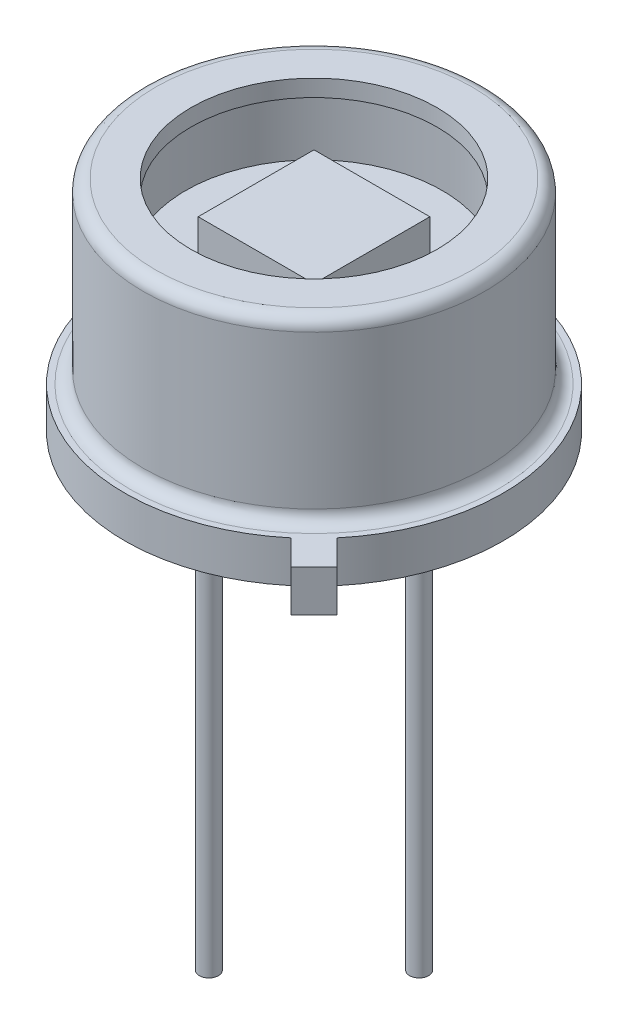
from build123d import *

# Parameters (mm, degrees)
BOSS_EXTRUDE1_DEPTH      = 1
FILLET1_R                = 0.3
BOSS_EXTRUDE2_DEPTH      = 10
BOSS_EXTRUDE2_DEPTH_BACK = 2.3
SKETCH6_R                = 0.23
SKETCH_2_R               = 3.1
EXTRUDE_1_DEPTH          = 1.2
SKETCH_3_W               = 2.8
SKETCH_3_H               = 2.8
EXTRUDE_2_DEPTH          = 1


with BuildPart() as part:
    # Sketch1 → Boss-Extrude1 (new body)
    with BuildSketch(Plane(origin=(0, 0, 0), x_dir=(1, 0, 0), z_dir=(0, 1, 0))):
        with BuildLine():
            Line((2.942495814, -3.499271693), (3.55315323, -4.10992911))
            Line((3.55315323, -4.10992911), (4.10992911, -3.55315323))
            Line((4.10992911, -3.55315323), (3.499271693, -2.942495814))
            ThreePointArc((3.499271693, -2.942495814), (-3.232892204, 3.232892204), (2.942495814, -3.499271693))
        make_face()
    extrude(amount=-BOSS_EXTRUDE1_DEPTH)

    # Sketch5 → Revolve4 (revolve)
    with BuildSketch(Plane.XY):
        Polygon((4.1275, 4.3), (2.9718, 4.3), (2.9718, 3.8936), (3.7211, 3.8936), (3.7211, 0.8936), (0, 0.8936), (0, 0), (4.1275, 0), align=None)
    revolve(axis=Axis((0, 0.8936, 0), (0, -1, 0)))

    # Fillet1
    fillet1_edges = [part.edges().sort_by_distance(p)[0] for p in [
        (-4.1275, 0, 0),
        (-4.1275, 4.3, 0),
    ]]
    fillet(fillet1_edges, radius=FILLET1_R)

    # Sketch6 → Boss-Extrude2 (add, two sides: drawn at the far end of the back side and taken through both)
    with BuildSketch(Plane.XZ.offset(1).offset(-BOSS_EXTRUDE2_DEPTH_BACK)):
        with Locations(Location((0, -2.54, 0), (0, 0, 270))):
            Circle(SKETCH6_R)
        with Locations(Location((-2.54, 0, 0), (0, 0, 270))):
            Circle(SKETCH6_R)
        with Locations(Location((0, 2.54, 0), (0, 0, 270))):
            Circle(SKETCH6_R)
        with Locations(Location((2.54, 0, 0), (0, 0, 270))):
            Circle(SKETCH6_R)
    extrude(amount=BOSS_EXTRUDE2_DEPTH + BOSS_EXTRUDE2_DEPTH_BACK)

    # Эскиз2 → Бобышка-Вытянуть1 (add)
    with BuildSketch(Plane(origin=(0, 1.3, 0), x_dir=(1, 0, 0), z_dir=(0, 1, 0))):
        with Locations(Location((0, 0, 0), (0, 0, 270))):
            Circle(SKETCH_2_R)
    extrude(amount=EXTRUDE_1_DEPTH)

    # Эскиз3 → Бобышка-Вытянуть2 (add)
    with BuildSketch(Plane(origin=(0, 2.5, 0), x_dir=(1, 0, 0), z_dir=(0, 1, 0))):
        Rectangle(SKETCH_3_W, SKETCH_3_H)
    extrude(amount=EXTRUDE_2_DEPTH)


solid = part.part
